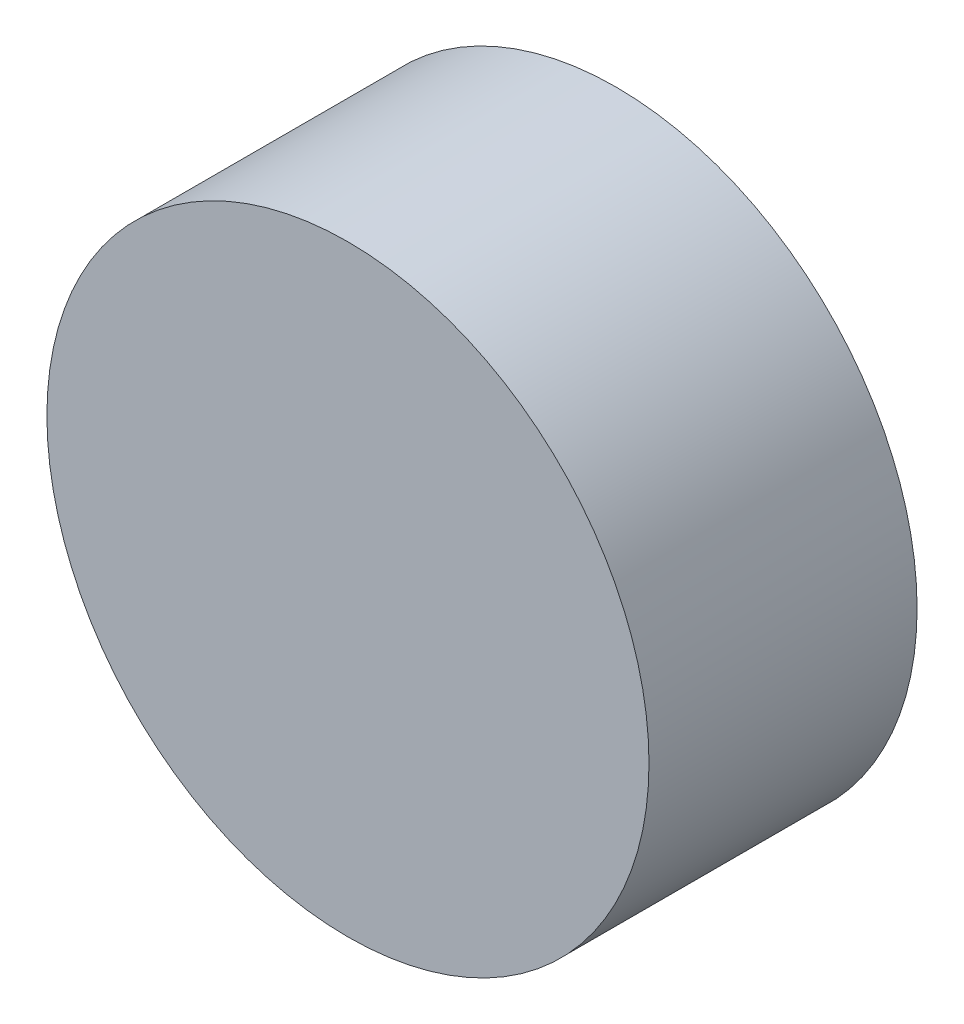
from build123d import *

# Parameters (mm, degrees)
CURVESKETCH_R   = 13.173
CURVEBOSS_DEPTH = 11.731


with BuildPart() as part:
    # CurveSketch → CurveBoss (new body)
    with BuildSketch(Plane.XY):
        with Locations((-11.731, 7.391)):
            Circle(CURVESKETCH_R)
    extrude(amount=CURVEBOSS_DEPTH)


solid = part.part
